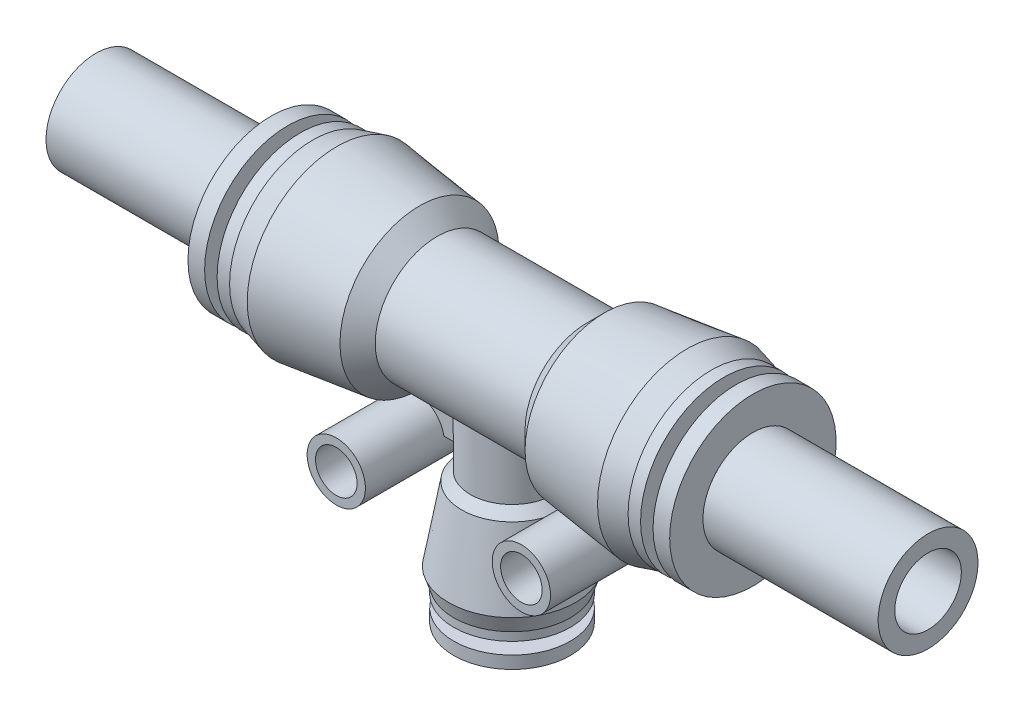
from build123d import *

# Parameters (mm, degrees)
EXTRUDE_1_REACH      = 39.211
EXTRUDE_1_END_RADIUS = 7.436443358
SKETCH_4_R           = 5
SKETCH_4_R_2         = 4
SKETCH_5_R           = 3.5
SKETCH_5_R_2         = 2.5
EXTRUDE_5_DEPTH      = 10
EXTRUDE_5_2_DEPTH    = 10
EXTRUDE_7_DEPTH      = 0.5
SKETCH_8_R           = 4
CUT_EXTRUDE_1_DEPTH  = 27
SKETCH_11_R          = 6
SKETCH_11_R_2        = 4
EXTRUDE_8_DEPTH      = 21.06
SKETCH_13_R          = 6
SKETCH_13_R_2        = 4
EXTRUDE_10_DEPTH     = 21.05


with BuildPart() as part:
    # 草图1 → 旋转1 (revolve)
    with BuildSketch(Plane.XY):
        Polygon((-9, 0), (9, 0), (11.121320344, 2.121320344), (21.04678186, 3.340013778), (23.944559339, 2.563556642), (25.444559339, 2.563556642), (25.444559339, -0.933223307), (26.944559339, -0.933223307), (26.944559339, 2.563556642), (28.944559339, 2.563556642), (28.944559339, -1.436443358), (26.944559339, -1.436443358), (25.444559339, -1.436443358), (-25.444559339, -1.436443358), (-26.944559339, -1.436443358), (-28.944559339, -1.436443358), (-28.944559339, 2.563556642), (-26.944559339, 2.563556642), (-26.944559339, -0.933223307), (-25.444559339, -0.933223307), (-25.444559339, 2.563556642), (-23.944559339, 2.563556642), (-21.04678186, 3.340013778), (-11.121320344, 2.121320344), align=None)
    revolve(axis=Axis((-35.560653072, -7.436443358, 0), (1, 0, 0)))



with BuildPart() as body_2:
    # 草图2 → 旋转2 (revolve)
    with BuildSketch(Plane.XY):
        Polygon((5, -14.872886715), (4, -14.872886715), (4, -29.608749696), (4.004855848, -32.555274694), (4.004855848, -34.055274694), (4.004010868, -35.626472803), (7.004010868, -35.626472803), (7.004010868, -34.126472803), (4.637164002, -34.126472803), (4.637164002, -32.697630804), (7.001476401, -32.697630804), (7.001476401, -31.697630804), (7.623493771, -29.796816664), (6.060660172, -20.933546887), (5, -19.872886715), align=None)
    revolve(axis=Axis((0, 0, 0), (0, -1, 0)))


with BuildPart() as part_1:
    add(part.part)

    add(body_2.part)  # 凸台-拉伸1 merges body 2
    # 凸台-拉伸1: up to this cylinder (the profile starts outside it)
    extrude_1_end = Plane(origin=(-4.858579, -7.436443358, 0), z_dir=(-1, 0, 0)) * Cylinder(EXTRUDE_1_END_RADIUS, 94.294886715, mode=Mode.PRIVATE)
    # 草图4 → 凸台-拉伸1 (add, up to the surface)
    with BuildSketch(Plane(origin=(0, -14.872886715, 0), x_dir=(1, 0, 0), z_dir=(0, 1, 0)), mode=Mode.PRIVATE) as extrude_1_sk1:
        Circle(SKETCH_4_R)
        Circle(SKETCH_4_R_2, mode=Mode.SUBTRACT)
    extrude_1_tool1 = extrude(extrude_1_sk1.sketch, amount=EXTRUDE_1_REACH, mode=Mode.PRIVATE) - extrude_1_end
    add(extrude_1_tool1.solids().sort_by_distance((-4.858579, -14.872887, 0))[0])
    add(extrude_1_tool1.solids().sort_by_distance((-4.858579, -14.872887, 0))[1])

    # 草图8 → 切除-拉伸1 (cut)
    with BuildSketch(Plane(origin=(0, -35.626472803, 0), x_dir=(-1, 0, 0), z_dir=(0, -1, 0))):
        Circle(SKETCH_8_R)
    extrude(amount=-CUT_EXTRUDE_1_DEPTH, mode=Mode.SUBTRACT)


with BuildPart() as body_2_2:
    # 草图5 → 凸台-拉伸5 (new, symmetric)
    with BuildSketch(Plane.XY):
        with Locations((11.121320344, -20.520491448)):
            Circle(SKETCH_5_R)
        with Locations((11.121320344, -20.520491448)):
            Circle(SKETCH_5_R_2, mode=Mode.SUBTRACT)
    extrude(amount=EXTRUDE_5_DEPTH, both=True)


with BuildPart() as body_3:
    # 草图5 → Extrude 5 2 (new, symmetric)
    with BuildSketch(Plane.XY):
        with Locations((-11.121320344, -20.520491448)):
            Circle(SKETCH_5_R)
        with Locations((-11.121320344, -20.520491448)):
            Circle(SKETCH_5_R_2, mode=Mode.SUBTRACT)
    extrude(amount=EXTRUDE_5_2_DEPTH, both=True)


    add(body_2_2.part)  # 凸台-拉伸7 merges body 2 2
    # 草图5<9> → 凸台-拉伸7 (add, symmetric)
    with BuildSketch(Plane.XY):
        with BuildLine():
            Line((9, -14.872886715), (5, -14.872886715))
            Line((5, -14.872886715), (5, -19.872886715))
            Line((5, -19.872886715), (7.681755239, -19.872886715))
            ThreePointArc((7.681755239, -19.872886715), (8.887110927, -17.826366677), (11.121320344, -17.020491448))
            Line((11.121320344, -17.020491448), (9, -14.872886715))
        make_face()
        with BuildLine():
            Line((-9, -14.872886715), (-11.121320344, -17.020491448))
            ThreePointArc((-11.121320344, -17.020491448), (-8.887110927, -17.826366677), (-7.681755239, -19.872886715))
            Line((-7.681755239, -19.872886715), (-5, -19.872886715))
            Line((-5, -19.872886715), (-5, -14.872886715))
            Line((-5, -14.872886715), (-9, -14.872886715))
        make_face()
    extrude(amount=EXTRUDE_7_DEPTH, both=True)


with BuildPart() as body_3_2:
    # 草图11 → 凸台-拉伸8 (new body)
    with BuildSketch(Plane.ZY.offset(28.944559339)):
        with Locations((0, -7.436443358)):
            Circle(SKETCH_11_R)
        with Locations((0, -7.436443358)):
            Circle(SKETCH_11_R_2, mode=Mode.SUBTRACT)
    extrude(amount=EXTRUDE_8_DEPTH)


with BuildPart() as body_4:
    # 草图13 → 凸台-拉伸10 (new body)
    with BuildSketch(Plane(origin=(28.944559339, 0, 0), x_dir=(0, 0, -1), z_dir=(1, 0, 0))):
        with Locations((0, -7.436443358)):
            Circle(SKETCH_13_R)
        with Locations((0, -7.436443358)):
            Circle(SKETCH_13_R_2, mode=Mode.SUBTRACT)
    extrude(amount=EXTRUDE_10_DEPTH)


solid = Compound([part_1.part, body_3.part, body_3_2.part, body_4.part])
